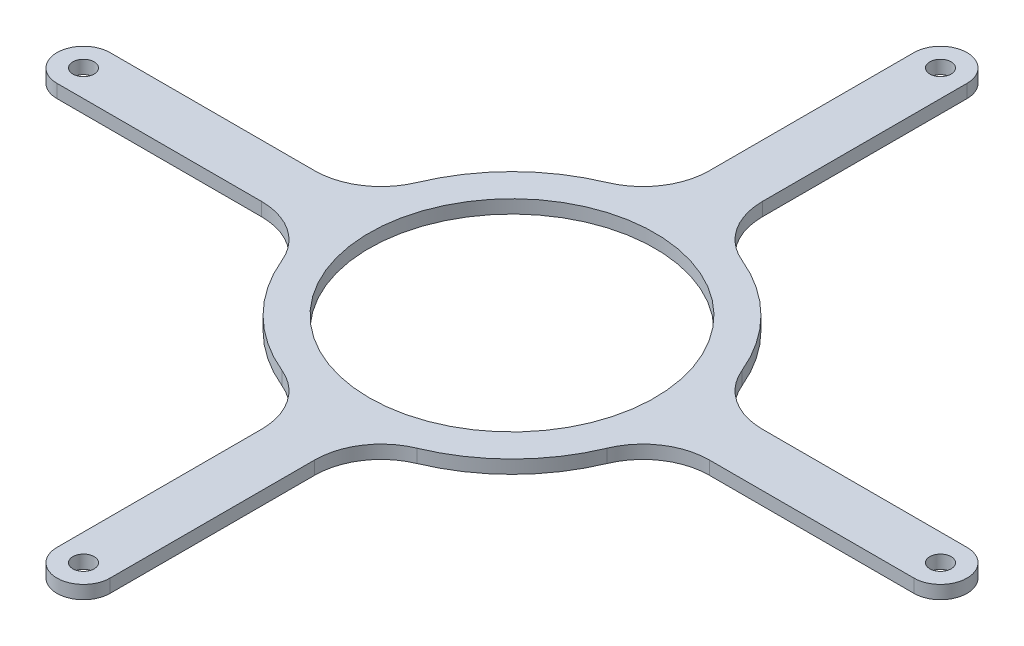
from build123d import *

# Parameters (mm, degrees)
SKETCH1_R           = 21.5
SKETCH1_R_2         = 1.6
BOSS_EXTRUDE1_DEPTH = 2
FILLET1_R           = 10


with BuildPart() as part:
    # Sketch1 → Boss-Extrude1 (new body)
    with BuildSketch(Plane(origin=(0, 0, 0), x_dir=(1, 0, 0), z_dir=(0, 1, 0))):
        with BuildLine():
            Line((4, 26.196373795), (4, 64.5))
            ThreePointArc((4, 64.5), (0, 68.5), (-4, 64.5))
            Line((-4, 64.5), (-4, 26.196373795))
            ThreePointArc((-4, 26.196373795), (-18.738329701, 18.738329701), (-26.196373795, 4))
            Line((-26.196373795, 4), (-64.5, 4))
            ThreePointArc((-64.5, 4), (-68.5, 0), (-64.5, -4))
            Line((-64.5, -4), (-26.196373795, -4))
            ThreePointArc((-26.196373795, -4), (-18.738329701, -18.738329701), (-4, -26.196373795))
            Line((-4, -26.196373795), (-4, -64.5))
            ThreePointArc((-4, -64.5), (0, -68.5), (4, -64.5))
            Line((4, -64.5), (4, -26.196373795))
            ThreePointArc((4, -26.196373795), (18.738329701, -18.738329701), (26.196373795, -4))
            Line((26.196373795, -4), (64.5, -4))
            ThreePointArc((64.5, -4), (68.5, 0), (64.5, 4))
            Line((64.5, 4), (26.196373795, 4))
            ThreePointArc((26.196373795, 4), (18.738329701, 18.738329701), (4, 26.196373795))
        make_face()
        with Locations(Location((0, 0, 0), (0, 0, 270))):
            Circle(SKETCH1_R, mode=Mode.SUBTRACT)
        with Locations(Location((0, 64.5, 0), (0, 0, 270))):
            Circle(SKETCH1_R_2, mode=Mode.SUBTRACT)
        with Locations(Location((64.5, 0, 0), (0, 0, 270))):
            Circle(SKETCH1_R_2, mode=Mode.SUBTRACT)
        with Locations(Location((0, -64.5, 0), (0, 0, 270))):
            Circle(SKETCH1_R_2, mode=Mode.SUBTRACT)
        with Locations(Location((-64.5, 0, 0), (0, 0, 270))):
            Circle(SKETCH1_R_2, mode=Mode.SUBTRACT)
    extrude(amount=BOSS_EXTRUDE1_DEPTH)

    # Fillet1
    fillet1_edges = [part.edges().sort_by_distance(p)[0] for p in [
        (26.196373795, 1, -4),
        (26.196373795, 1, 4),
        (4, 1, 26.196373795),
        (-4, 1, 26.196373795),
        (-26.196373795, 1, 4),
        (-26.196373795, 1, -4),
        (-4, 1, -26.196373795),
        (4, 1, -26.196373795),
    ]]
    fillet(fillet1_edges, radius=FILLET1_R)


solid = part.part
